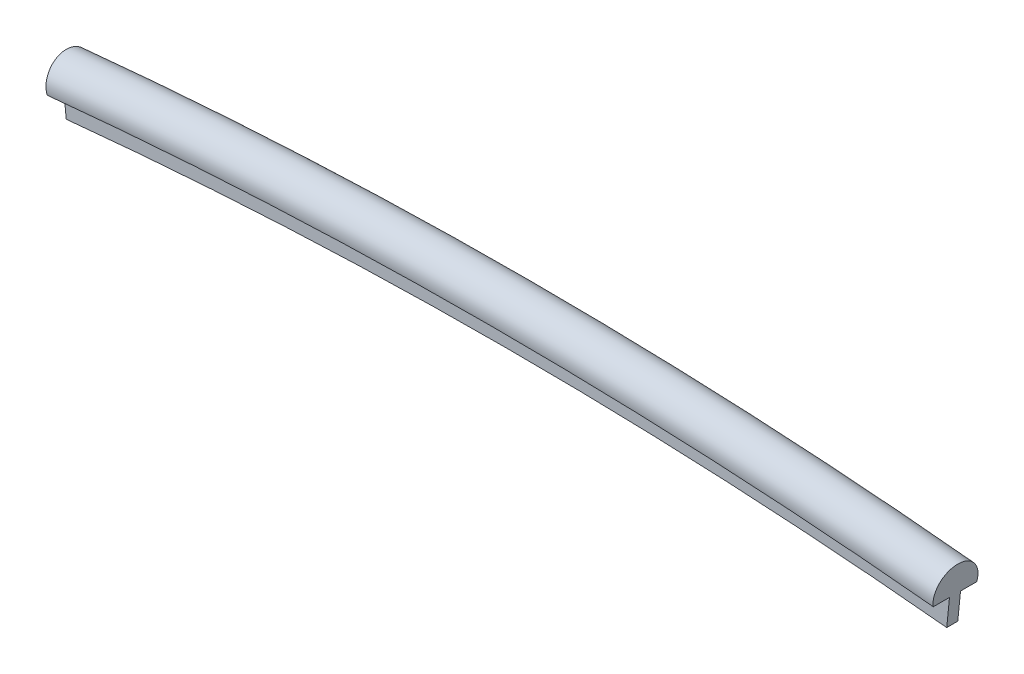
from build123d import *

# Parameters (mm, degrees)
REVOLVE1_ANGLE           = 5.717710468
REVOLVE1_OTHER_WAY_ANGLE = 5.717710468


with BuildPart() as part:
    # Sketch2 → Revolve1 (revolve)
    with BuildSketch(Plane(origin=(0, 0, 0), x_dir=(0, 0, -1), z_dir=(1, 0, 0))):
        with BuildLine():
            Line((0, 239.8), (0.3, 239.8))
            Line((0.3, 239.8), (0.3, 241.3))
            Line((0.3, 241.3), (1.18, 241.3))
            ThreePointArc((1.18, 241.3), (0, 242.800182019), (-1.18, 241.3))
            Line((-1.18, 241.3), (-0.3, 241.3))
            Line((-0.3, 241.3), (-0.3, 239.8))
            Line((-0.3, 239.8), (0, 239.8))
        make_face()
    revolve(axis=Axis((0, 0, 70.597641597), (0, 0, -1)), revolution_arc=REVOLVE1_ANGLE)

    # Sketch2 → Revolve1 other way (revolve)
    with BuildSketch(Plane(origin=(0, 0, 0), x_dir=(0, 0, -1), z_dir=(1, 0, 0))):
        with BuildLine():
            Line((0, 239.8), (0.3, 239.8))
            Line((0.3, 239.8), (0.3, 241.3))
            Line((0.3, 241.3), (1.18, 241.3))
            ThreePointArc((1.18, 241.3), (0, 242.800182019), (-1.18, 241.3))
            Line((-1.18, 241.3), (-0.3, 241.3))
            Line((-0.3, 241.3), (-0.3, 239.8))
            Line((-0.3, 239.8), (0, 239.8))
        make_face()
    revolve(axis=Axis((0, 0, 70.597641597), (0, 0, 1)), revolution_arc=REVOLVE1_OTHER_WAY_ANGLE)


solid = part.part
